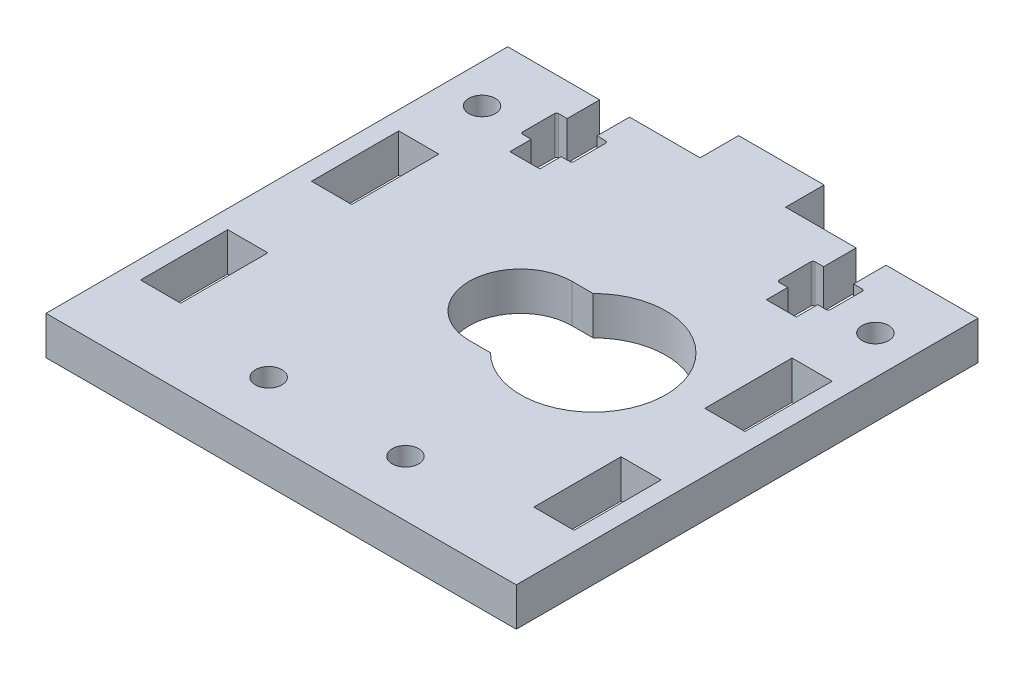
from build123d import *

# Parameters (mm, degrees)
SKETCH1_W           = 55
SKETCH1_H           = 54
MAINSHAPE_DEPTH     = 4.5
SKETCH2_W           = 10
SKETCH2_H           = 9
TAB1_DEPTH          = 4.5
CUT_EXTRUDE2_DEPTH  = 43.056509603
SKETCH5_W           = 4.7
SKETCH5_H           = 10.2
CUT_EXTRUDE3_DEPTH  = 43.056509603
SKETCH6_R           = 12
CUT_EXTRUDE4_DEPTH  = 43.056509603
SKETCH8_R           = 1.55
CUT_EXTRUDE6_DEPTH  = 43.056509603
SKETCH11_R          = 1.55
CUT_EXTRUDE8_DEPTH  = 43.056509603
SKETCH15_R          = 12
SKETCH15_R_2        = 6
BOSS_EXTRUDE2_DEPTH = 4.5
CUT_EXTRUDE10_DEPTH = 43.056509603


with BuildPart() as part:
    # Sketch1 → MainShape (new body)
    with BuildSketch(Plane(origin=(0, 0, 0), x_dir=(1, 0, 0), z_dir=(0, 1, 0))):
        Rectangle(SKETCH1_W, SKETCH1_H)
    extrude(amount=MAINSHAPE_DEPTH)

    # Sketch2 → Tab1 (add, through all)
    with BuildSketch(Plane(origin=(0, 4.5, 0), x_dir=(1, 0, 0), z_dir=(0, 1, 0))):
        with Locations((0, 27)):
            Rectangle(SKETCH2_W, SKETCH2_H)
    extrude(amount=-TAB1_DEPTH)

    # Sketch4 → Cut-Extrude2 (cut, through all)
    with BuildSketch(Plane(origin=(0, 4.5, 0), x_dir=(1, 0, 0), z_dir=(0, 1, 0))):
        with BuildLine():
            Line((-13.25, 16.5), (-16.75, 16.5))
            Line((-16.75, 16.5), (-16.75, 19))
            Line((-16.75, 19), (-17.75, 19))
            ThreePointArc((-17.75, 19), (-17.926776695, 19.073223305), (-18, 19.25))
            Line((-18, 19.25), (-18, 22.95))
            ThreePointArc((-18, 22.95), (-17.926776695, 23.126776695), (-17.75, 23.2))
            Line((-17.75, 23.2), (-16.75, 23.2))
            Line((-16.75, 23.2), (-16.75, 27))
            Line((-16.75, 27), (-13.25, 27))
            Line((-13.25, 27), (-13.25, 23.2))
            Line((-13.25, 23.2), (-12.25, 23.2))
            ThreePointArc((-12.25, 23.2), (-12.073223305, 23.126776695), (-12, 22.95))
            Line((-12, 22.95), (-12, 19.25))
            ThreePointArc((-12, 19.25), (-12.073223305, 19.073223305), (-12.25, 19))
            Line((-12.25, 19), (-13.25, 19))
            Line((-13.25, 19), (-13.25, 16.5))
        make_face()
        with BuildLine():
            Line((13.25, 16.5), (13.25, 19))
            Line((13.25, 19), (12.25, 19))
            ThreePointArc((12.25, 19), (12.073223305, 19.073223305), (12, 19.25))
            Line((12, 19.25), (12, 22.95))
            ThreePointArc((12, 22.95), (12.073223305, 23.126776695), (12.25, 23.2))
            Line((12.25, 23.2), (13.25, 23.2))
            Line((13.25, 23.2), (13.25, 27))
            Line((13.25, 27), (16.75, 27))
            Line((16.75, 27), (16.75, 23.2))
            Line((16.75, 23.2), (17.75, 23.2))
            ThreePointArc((17.75, 23.2), (17.926776695, 23.126776695), (18, 22.95))
            Line((18, 22.95), (18, 19.25))
            ThreePointArc((18, 19.25), (17.926776695, 19.073223305), (17.75, 19))
            Line((17.75, 19), (16.75, 19))
            Line((16.75, 19), (16.75, 16.5))
            Line((16.75, 16.5), (13.25, 16.5))
        make_face()
    extrude(amount=-CUT_EXTRUDE2_DEPTH, mode=Mode.SUBTRACT)

    # Sketch5 → Cut-Extrude3 (cut, through all)
    with BuildSketch(Plane(origin=(0, 4.5, 0), x_dir=(1, 0, 0), z_dir=(0, 1, 0))):
        with Locations((23, 7)):
            Rectangle(SKETCH5_W, SKETCH5_H)
        with Locations((-23, 7)):
            Rectangle(SKETCH5_W, SKETCH5_H)
        with Locations((-23, -13)):
            Rectangle(SKETCH5_W, SKETCH5_H)
        with Locations((23, -13)):
            Rectangle(SKETCH5_W, SKETCH5_H)
    extrude(amount=-CUT_EXTRUDE3_DEPTH, mode=Mode.SUBTRACT)

    # Sketch6 → Cut-Extrude4 (cut, through all)
    with BuildSketch(Plane(origin=(0, 4.5, 0), x_dir=(1, 0, 0), z_dir=(0, 1, 0))):
        with Locations(Location((0, 1, 0), (0, 0, 270))):
            Circle(SKETCH6_R)
    extrude(amount=-CUT_EXTRUDE4_DEPTH, mode=Mode.SUBTRACT)

    # Sketch8 → Cut-Extrude6 (cut, through all)
    with BuildSketch(Plane(origin=(0, 4.5, 0), x_dir=(1, 0, 0), z_dir=(0, 1, 0))):
        with Locations(Location((-8, -20.46, 0), (0, 0, 270))):
            Circle(SKETCH8_R)
        with Locations(Location((8, -20.46, 0), (0, 0, 90))):
            Circle(SKETCH8_R)
    extrude(amount=-CUT_EXTRUDE6_DEPTH, mode=Mode.SUBTRACT)

    # Sketch11 → Cut-Extrude8 (cut, through all)
    with BuildSketch(Plane(origin=(0, 4.5, 0), x_dir=(1, 0, 0), z_dir=(0, 1, 0))):
        with Locations(Location((-23, 19.5, 0), (0, 0, 270))):
            Circle(SKETCH11_R)
        with Locations(Location((23, 19.5, 0), (0, 0, 90))):
            Circle(SKETCH11_R)
    extrude(amount=-CUT_EXTRUDE8_DEPTH, mode=Mode.SUBTRACT)

    # Sketch15 → Boss-Extrude2 (add, through all)
    with BuildSketch(Plane(origin=(0, 4.5, 0), x_dir=(1, 0, 0), z_dir=(0, 1, 0))):
        with Locations((0, 1)):
            Circle(SKETCH15_R)
        with Locations(Location((0, 1, 0), (0, 0, 270))):
            Circle(SKETCH15_R_2, mode=Mode.SUBTRACT)
    extrude(amount=-BOSS_EXTRUDE2_DEPTH)

    # Sketch16 → Cut-Extrude10 (cut, through all)
    with BuildSketch(Plane(origin=(0, 4.5, 0), x_dir=(1, 0, 0), z_dir=(0, 1, 0))):
        with BuildLine():
            Line((0, 7), (2.479202711, 7))
            ThreePointArc((2.479202711, 7), (17, 1), (2.479202711, -5))
            Line((2.479202711, -5), (0, -5))
            Line((0, -5), (0, 7))
        make_face()
    extrude(amount=-CUT_EXTRUDE10_DEPTH, mode=Mode.SUBTRACT)


solid = part.part
